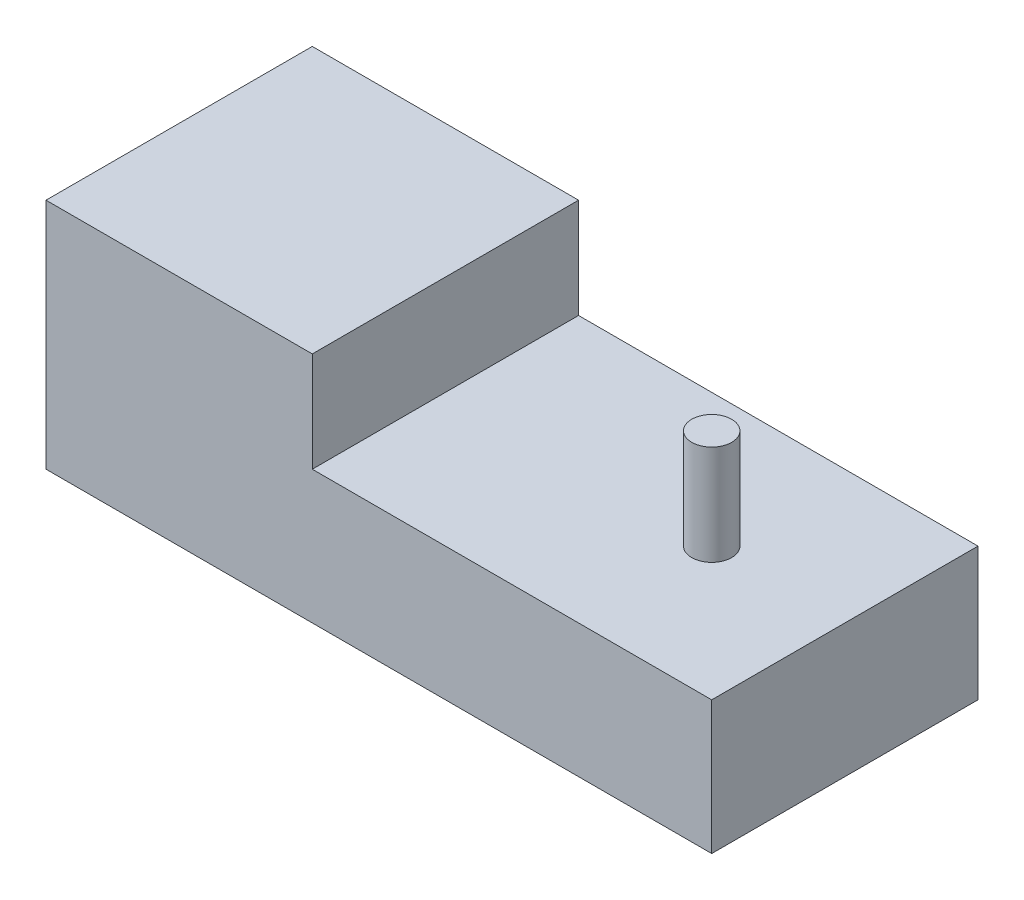
from build123d import *

# Parameters (mm, degrees)
SKETCH1_W           = 100
SKETCH1_H           = 40
BOSS_EXTRUDE1_DEPTH = 20
SKETCH2_R           = 3
BOSS_EXTRUDE2_DEPTH = 15
SKETCH3_W           = 40
SKETCH3_H           = 40
BOSS_EXTRUDE3_DEPTH = 15


with BuildPart() as part:
    # Sketch1 → Boss-Extrude1 (new body)
    with BuildSketch(Plane(origin=(0, 0, 0), x_dir=(1, 0, 0), z_dir=(0, 1, 0))):
        with Locations((50, 20)):
            Rectangle(SKETCH1_W, SKETCH1_H)
    extrude(amount=BOSS_EXTRUDE1_DEPTH)

    # Sketch2 → Boss-Extrude2 (add)
    with BuildSketch(Plane(origin=(0, 20, 0), x_dir=(1, 0, 0), z_dir=(0, 1, 0))):
        with Locations(Location((80, 20, 0), (0, 0, 90))):
            Circle(SKETCH2_R)
    extrude(amount=BOSS_EXTRUDE2_DEPTH)

    # Sketch3 → Boss-Extrude3 (add)
    with BuildSketch(Plane(origin=(0, 20, 0), x_dir=(1, 0, 0), z_dir=(0, 1, 0))):
        with Locations((20, 20)):
            Rectangle(SKETCH3_W, SKETCH3_H)
    extrude(amount=BOSS_EXTRUDE3_DEPTH)


solid = part.part
